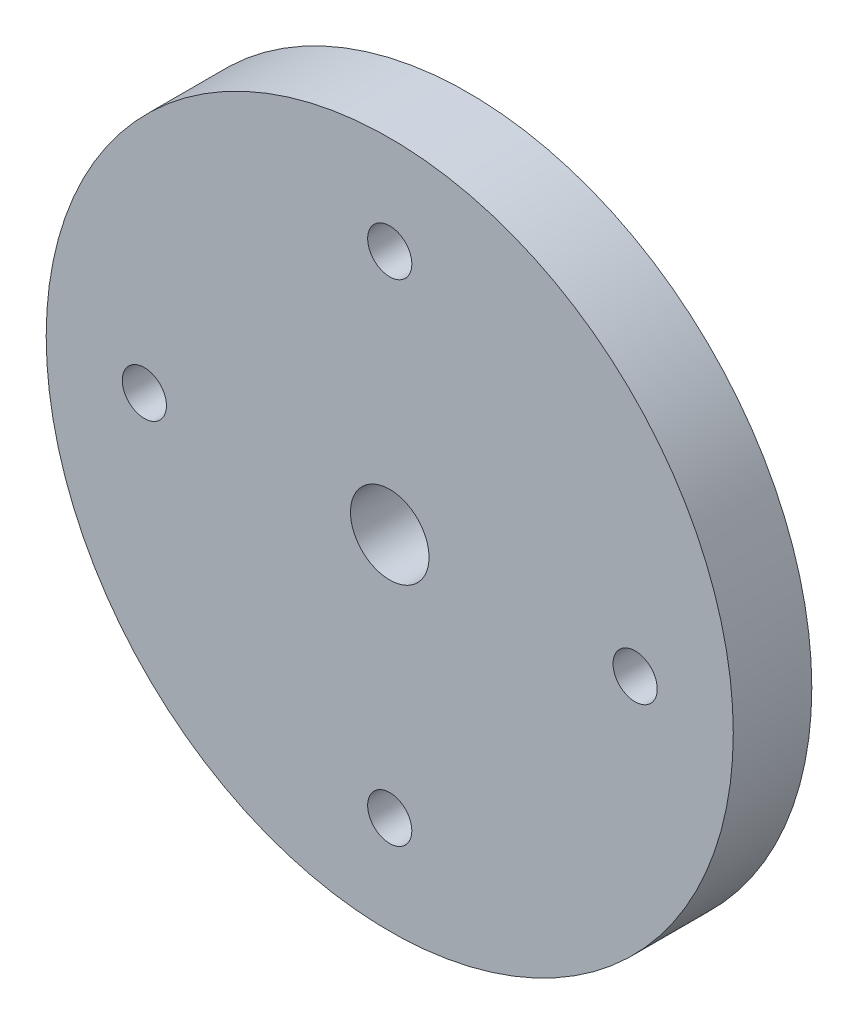
from build123d import *

# Parameters (mm, degrees)
GRIPPER_ADAPTER_R   = 35
GRIPPER_ADAPTER_R_2 = 4
GRIPPER_ADAPTER_R_3 = 2.25
F_8MM_DEPTH         = 8


with BuildPart() as part:
    # 外形与孔位_gripper_adapter → 板厚_8mm (new body)
    with BuildSketch(Plane.XY):
        with Locations((35, 35)):
            Circle(GRIPPER_ADAPTER_R)
        with Locations((35, 35)):
            Circle(GRIPPER_ADAPTER_R_2, mode=Mode.SUBTRACT)
        with Locations((60, 35)):
            Circle(GRIPPER_ADAPTER_R_3, mode=Mode.SUBTRACT)
        with Locations((35, 60)):
            Circle(GRIPPER_ADAPTER_R_3, mode=Mode.SUBTRACT)
        with Locations((10, 35)):
            Circle(GRIPPER_ADAPTER_R_3, mode=Mode.SUBTRACT)
        with Locations((35, 10)):
            Circle(GRIPPER_ADAPTER_R_3, mode=Mode.SUBTRACT)
    extrude(amount=F_8MM_DEPTH)


solid = part.part
